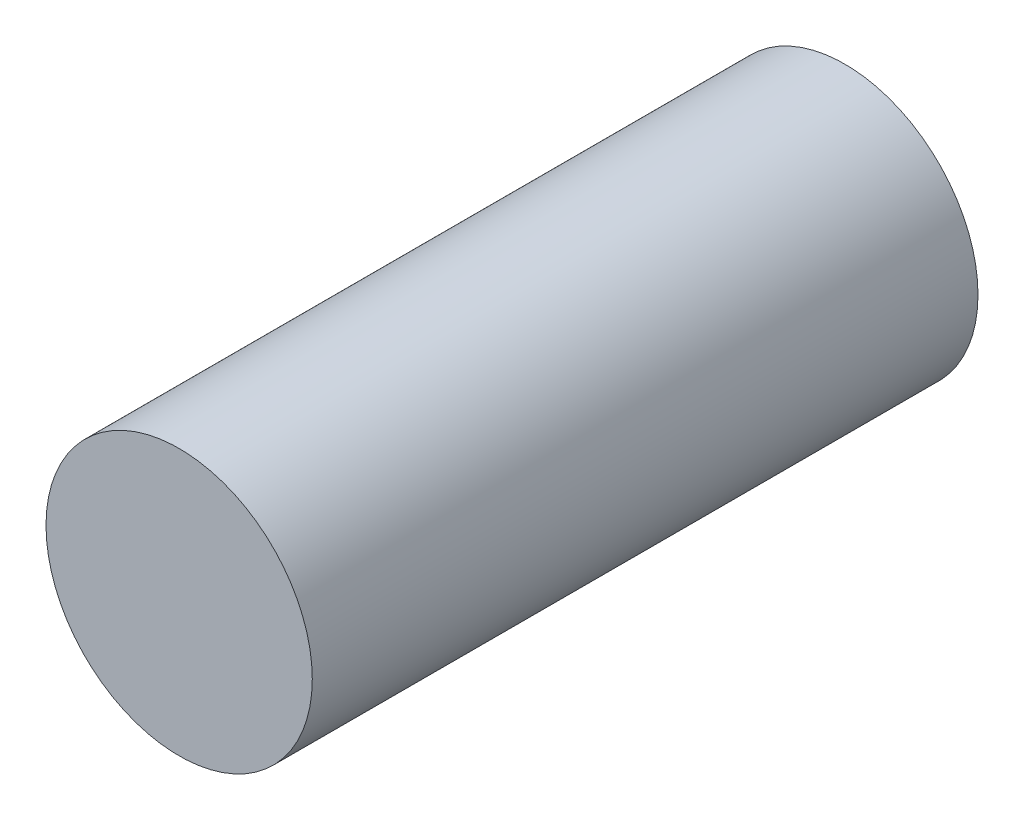
from build123d import *

# Parameters (mm, degrees)
SKETCH1_R           = 254
BOSS_EXTRUDE1_DEPTH = 1270


with BuildPart() as part:
    # Sketch1 → Boss-Extrude1 (new body)
    with BuildSketch(Plane.XY):
        with Locations(Location((0, 0, 0), (0, 0, 180))):
            Circle(SKETCH1_R)
    extrude(amount=BOSS_EXTRUDE1_DEPTH)


solid = part.part
